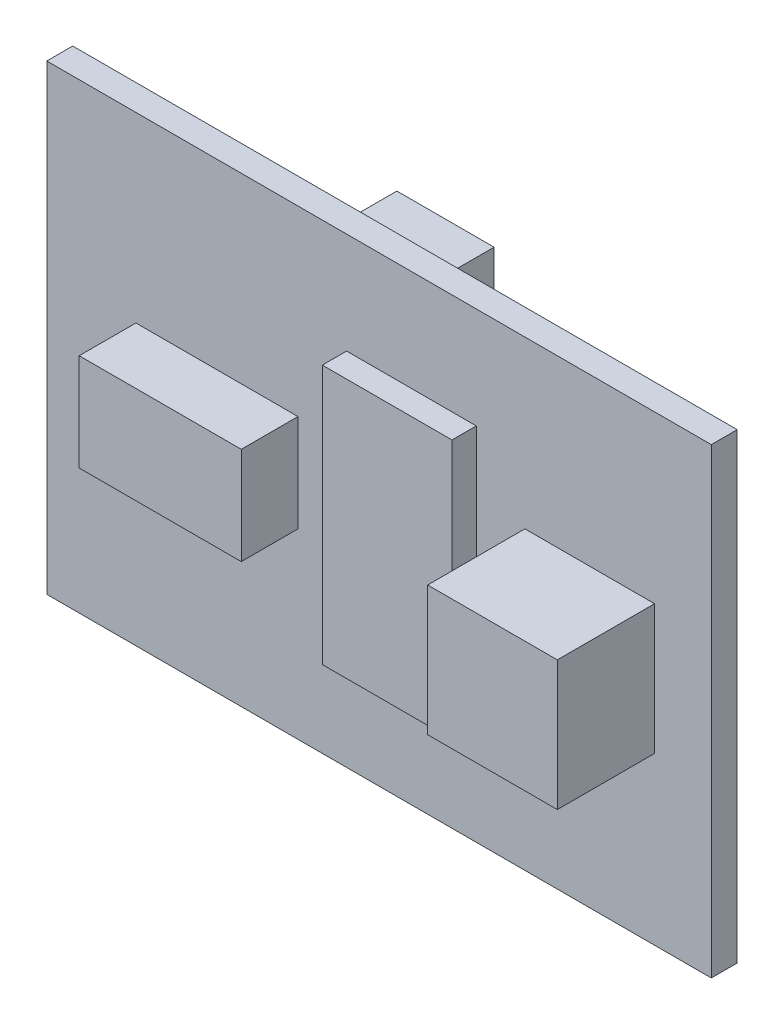
from build123d import *

# Parameters (mm, degrees)
SKETCH1_W           = 41
SKETCH1_H           = 28.5
BOSS_EXTRUDE1_DEPTH = 1.6
SKETCH2_W           = 6
SKETCH2_H           = 28
BOSS_EXTRUDE2_DEPTH = 2.5
SKETCH3_W           = 8
SKETCH3_H           = 8
BOSS_EXTRUDE3_DEPTH = 6
SKETCH4_W           = 10
SKETCH4_H           = 6
BOSS_EXTRUDE4_DEPTH = 3.5
SKETCH5_W           = 8
SKETCH5_H           = 16
BOSS_EXTRUDE5_DEPTH = 1.5


with BuildPart() as part:
    # Sketch1 → Boss-Extrude1 (new body)
    with BuildSketch(Plane.XY.offset(13.1)):
        with Locations((-10, 3.5)):
            Rectangle(SKETCH1_W, SKETCH1_H)
    extrude(amount=BOSS_EXTRUDE1_DEPTH)

    # Sketch2 → Boss-Extrude2 (add)
    with BuildSketch(Plane.XY.offset(10.6)):
        with Locations((-10, 3.5)):
            Rectangle(SKETCH2_W, SKETCH2_H)
    extrude(amount=BOSS_EXTRUDE2_DEPTH)

    # Sketch3 → Boss-Extrude3 (add)
    with BuildSketch(Plane.XY.offset(14.7)):
        with Locations((3, 3.5)):
            Rectangle(SKETCH3_W, SKETCH3_H)
    extrude(amount=BOSS_EXTRUDE3_DEPTH)

    # Sketch4 → Boss-Extrude4 (add)
    with BuildSketch(Plane.XY.offset(14.7)):
        with Locations((-20, 3.5)):
            Rectangle(SKETCH4_W, SKETCH4_H)
    extrude(amount=BOSS_EXTRUDE4_DEPTH)

    # Sketch5 → Boss-Extrude5 (add)
    with BuildSketch(Plane.XY.offset(14.7)):
        with Locations((-8, 3.5)):
            Rectangle(SKETCH5_W, SKETCH5_H)
    extrude(amount=BOSS_EXTRUDE5_DEPTH)


solid = part.part
